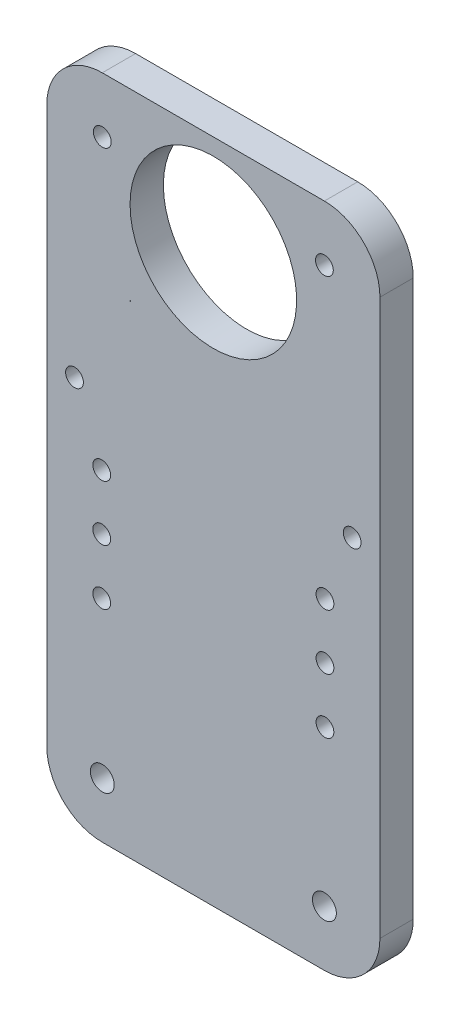
from build123d import *

# Parameters (mm, degrees)
SKETCH_1_W          = 60
SKETCH_1_H          = 120
SKETCH_1_R          = 1.6
SKETCH_1_R_2        = 2.15
EXTRUDE_3_DEPTH     = 6
SKETCH_9_R          = 1.6
CUT_EXTRUDE_1_DEPTH = 6
FILLET_1_R          = 10
SKETCH_10_R         = 1.6
CUT_EXTRUDE_2_DEPTH = 10
SKETCH_11_R         = 15
CUT_EXTRUDE_3_DEPTH = 10
EXTRUDE_START       = -6
SKETCH_12_R         = 1.6
EXTRUDE_4_DEPTH     = 6
EXTRUDE_5_DEPTH     = 6
SKETCH_14_R         = 15
CUT_EXTRUDE_4_DEPTH = 68.349832962


with BuildPart() as part:
    # 草图1 → 凸台-拉伸3 (new body)
    with BuildSketch(Plane.XY):
        Rectangle(SKETCH_1_W, SKETCH_1_H)
        with Locations((0, 50.5)):
            Circle(SKETCH_1_R, mode=Mode.SUBTRACT)
        with Locations((20, -50)):
            Circle(SKETCH_1_R_2, mode=Mode.SUBTRACT)
        with Locations((-20, -50)):
            Circle(SKETCH_1_R_2, mode=Mode.SUBTRACT)
        with Locations((13.423393759, 42.75)):
            Circle(SKETCH_1_R, mode=Mode.SUBTRACT)
        with Locations((13.423393759, 27.25)):
            Circle(SKETCH_1_R, mode=Mode.SUBTRACT)
        with Locations((0, 19.5)):
            Circle(SKETCH_1_R, mode=Mode.SUBTRACT)
        with Locations((-13.423393759, 27.25)):
            Circle(SKETCH_1_R, mode=Mode.SUBTRACT)
        with Locations((-13.423393759, 42.75)):
            Circle(SKETCH_1_R, mode=Mode.SUBTRACT)
        with BuildLine():
            Line((6, 42), (6, 28))
            ThreePointArc((6, 28), (0, 22), (-6, 28))
            Line((-6, 28), (-6, 42))
            ThreePointArc((-6, 42), (0, 48), (6, 42))
        make_face(mode=Mode.SUBTRACT)
    extrude(amount=EXTRUDE_3_DEPTH)

    # 草图9 → 切除-拉伸1 (cut)
    with BuildSketch(Plane.XY.offset(6)):
        with Locations((20.1, -22)):
            Circle(SKETCH_9_R)
        with Locations((20.1, -2)):
            Circle(SKETCH_9_R)
        with Locations((20.1, -12)):
            Circle(SKETCH_9_R)
        with Locations((-20.1, -2)):
            Circle(SKETCH_9_R)
        with Locations((-20.1, -12)):
            Circle(SKETCH_9_R)
        with Locations((-20.1, -22)):
            Circle(SKETCH_9_R)
    extrude(amount=-CUT_EXTRUDE_1_DEPTH, mode=Mode.SUBTRACT)

    # 圆角1
    fillet_1_edges = [part.edges().sort_by_distance(p)[0] for p in [
        (30, -60, 3),
        (-30, -60, 3),
        (-30, 60, 3),
        (30, 60, 3),
    ]]
    fillet(fillet_1_edges, radius=FILLET_1_R)

    # 草图10 → 切除-拉伸2 (cut)
    with BuildSketch(Plane(origin=(0, 0, 0), x_dir=(-1, 0, 0), z_dir=(0, 0, -1))):
        with Locations((-20, 50)):
            Circle(SKETCH_10_R)
        with Locations((-25, 10)):
            Circle(SKETCH_10_R)
        with Locations((25, 10)):
            Circle(SKETCH_10_R)
        with Locations((20, 50)):
            Circle(SKETCH_10_R)
    extrude(amount=-CUT_EXTRUDE_2_DEPTH, mode=Mode.SUBTRACT)

    # 草图11 → 切除-拉伸3 (cut)
    with BuildSketch(Plane.XY.offset(6)):
        with Locations((0, 28)):
            Circle(SKETCH_11_R)
    extrude(amount=-CUT_EXTRUDE_3_DEPTH, mode=Mode.SUBTRACT)

    # 草图12 → 凸台-拉伸4 (add)
    with BuildSketch(Plane.XY.offset(6).offset(EXTRUDE_START)):
        with BuildLine():
            ThreePointArc((5.994789404, 41.75), (5.99869721, 41.874972853), (6, 42))
            ThreePointArc((6, 42), (0, 48), (-6, 42))
            ThreePointArc((-6, 42), (-5.99869721, 41.874972853), (-5.994789404, 41.75))
            ThreePointArc((-5.994789404, 41.75), (0, 43), (5.994789404, 41.75))
        make_face()
        with Locations((-13.423393759, 42.75)):
            Circle(SKETCH_12_R)
        with Locations((0, 50.5)):
            Circle(SKETCH_12_R)
        with Locations((13.423393759, 42.75)):
            Circle(SKETCH_12_R)
    extrude(amount=EXTRUDE_4_DEPTH)

    # 草图13 → 凸台-拉伸5 (add)
    with BuildSketch(Plane(origin=(0, 0, 0), x_dir=(-1, 0, 0), z_dir=(0, 0, -1)).offset(EXTRUDE_START)):
        with BuildLine():
            ThreePointArc((13.266499161, 35), (0, 27), (-13.266499161, 35))
            ThreePointArc((-13.266499161, 35), (-14.611734824, 31.390752932), (-14.993484161, 27.557922277))
            ThreePointArc((-14.993484161, 27.557922277), (-14.976641564, 27.163215996), (-14.949410055, 26.769090172))
            ThreePointArc((-14.949410055, 26.769090172), (0, 13), (14.949410055, 26.769090172))
            ThreePointArc((14.949410055, 26.769090172), (14.976641564, 27.163215996), (14.993484161, 27.557922277))
            ThreePointArc((14.993484161, 27.557922277), (14.998370952, 27.77893713), (15, 28))
            ThreePointArc((15, 28), (14.560176637, 31.605725487), (13.266499161, 35))
        make_face()
    extrude(amount=EXTRUDE_5_DEPTH)

    # 草图14 → 切除-拉伸4 (cut, through all)
    with BuildSketch(Plane(origin=(0, 0, 0), x_dir=(-1, 0, 0), z_dir=(0, 0, -1))):
        with Locations((0, 42)):
            Circle(SKETCH_14_R)
    extrude(amount=-CUT_EXTRUDE_4_DEPTH, mode=Mode.SUBTRACT)


solid = part.part
